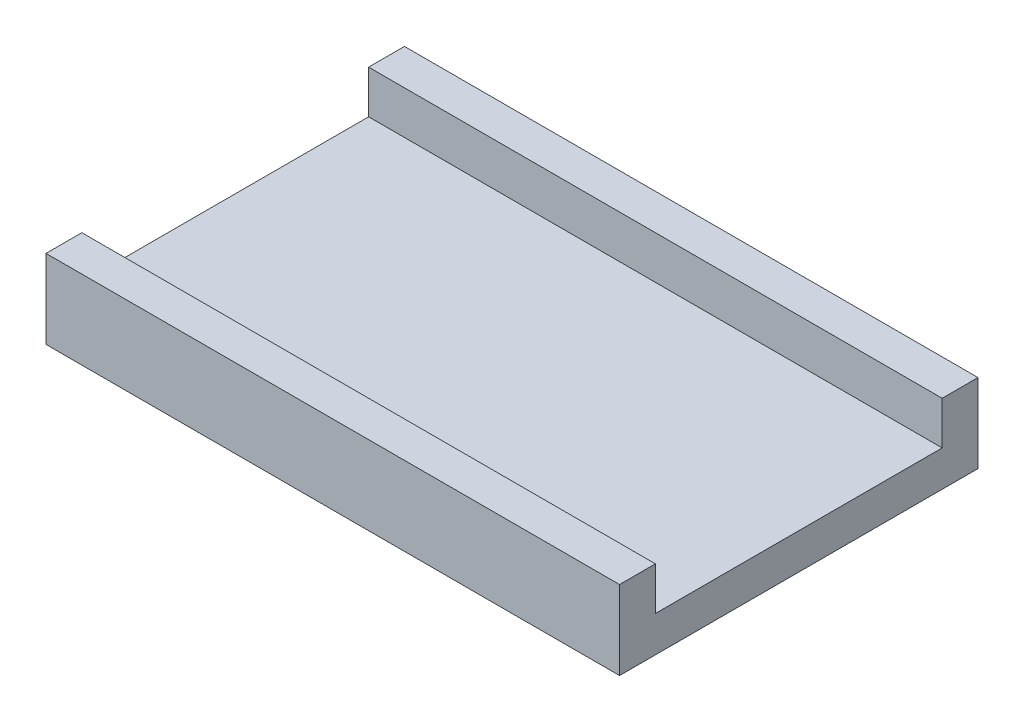
from build123d import *

# Parameters (mm, degrees)
SKETCH1_W           = 80
SKETCH1_H           = 40
SKETCH1_H_2         = 5
BOSS_EXTRUDE2_DEPTH = 5
SKETCH2_W           = 80
SKETCH2_H           = 5
BOSS_EXTRUDE3_DEPTH = 6


with BuildPart() as part:
    # Sketch1 → Boss-Extrude2 (new body)
    with BuildSketch(Plane(origin=(0, 0, 0), x_dir=(1, 0, 0), z_dir=(0, 1, 0))):
        with Locations((40, 25)):
            Rectangle(SKETCH1_W, SKETCH1_H)
        with Locations((40, 2.5)):
            Rectangle(SKETCH1_W, SKETCH1_H_2)
        with Locations((40, 47.5)):
            Rectangle(SKETCH1_W, SKETCH1_H_2)
    extrude(amount=BOSS_EXTRUDE2_DEPTH)

    # Sketch2 → Boss-Extrude3 (add)
    with BuildSketch(Plane(origin=(0, 5, 0), x_dir=(1, 0, 0), z_dir=(0, 1, 0))):
        with Locations((40, 47.5)):
            Rectangle(SKETCH2_W, SKETCH2_H)
        with Locations((40, 2.5)):
            Rectangle(SKETCH2_W, SKETCH2_H)
    extrude(amount=BOSS_EXTRUDE3_DEPTH)


solid = part.part
